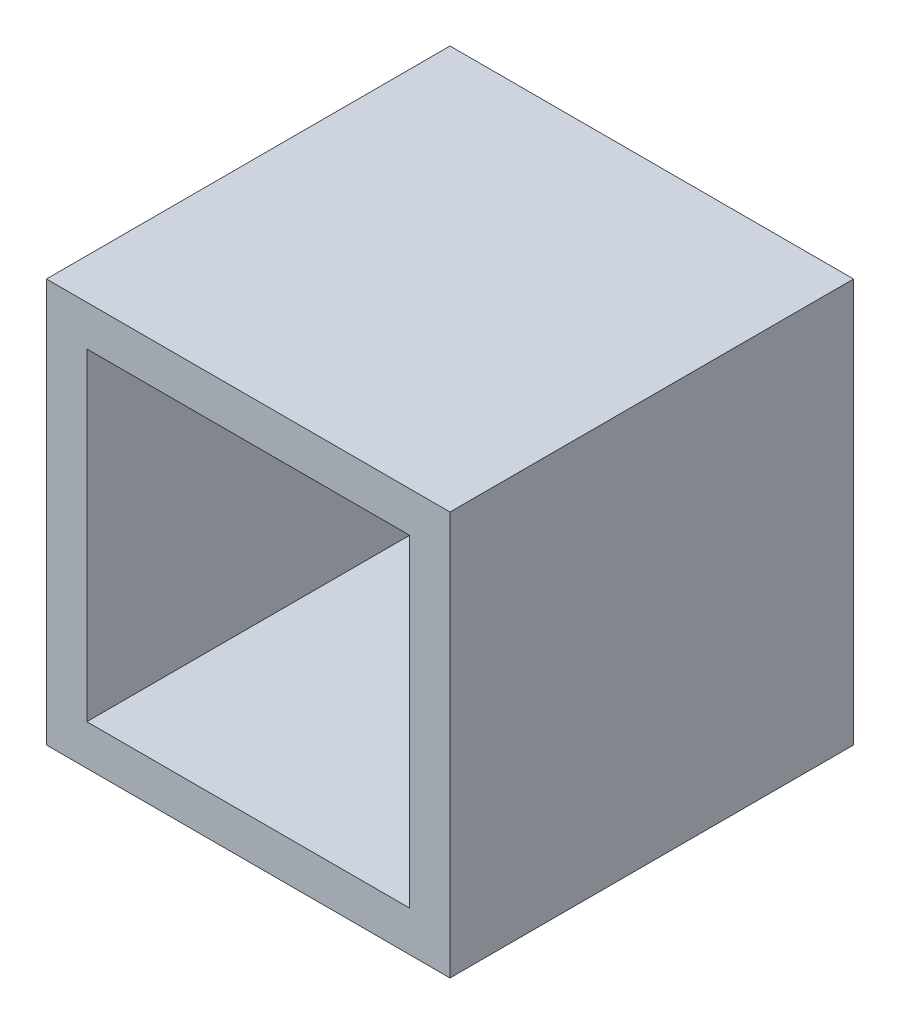
from build123d import *

# Parameters (mm, degrees)
SKETCH_1_W      = 10
SKETCH_1_H      = 10
SKETCH_1_W_2    = 8
SKETCH_1_H_2    = 8
EXTRUDE_1_DEPTH = 10


with BuildPart() as part:
    # 草图1 → 凸台-拉伸1 (new body)
    with BuildSketch(Plane.XY):
        Rectangle(SKETCH_1_W, SKETCH_1_H)
        Rectangle(SKETCH_1_W_2, SKETCH_1_H_2, mode=Mode.SUBTRACT)
    extrude(amount=EXTRUDE_1_DEPTH)


solid = part.part
